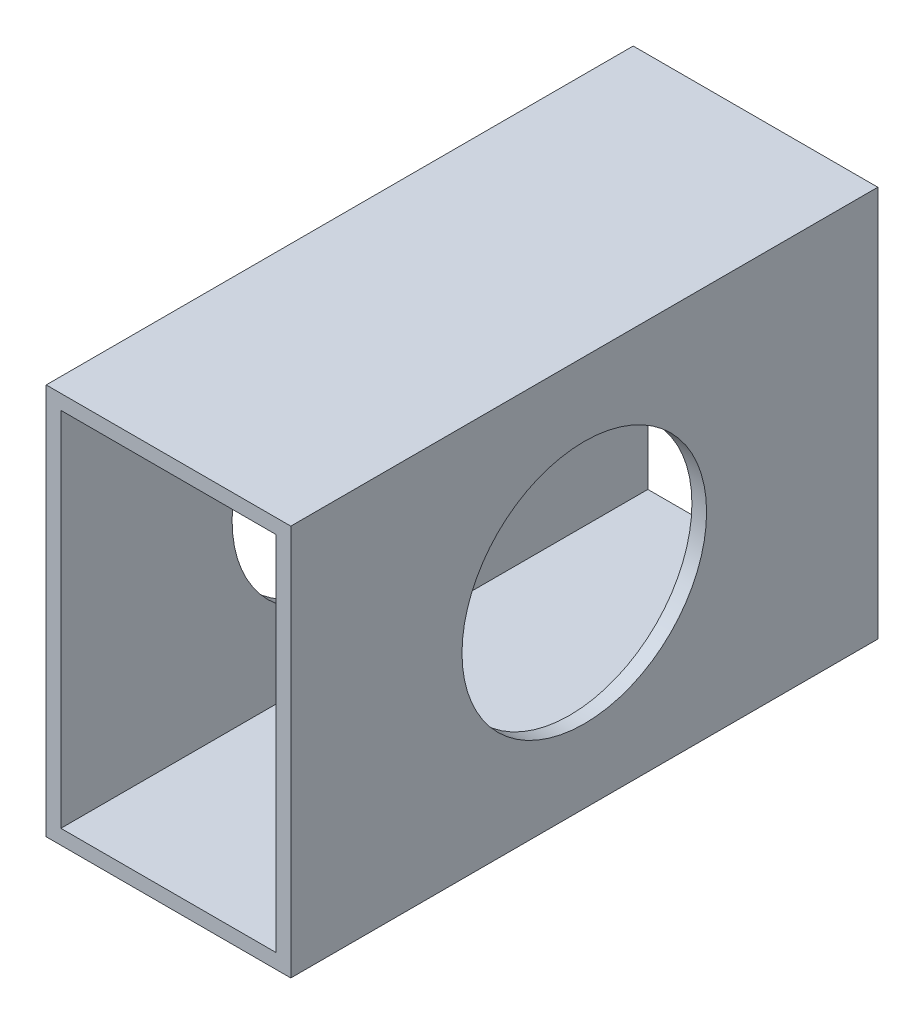
from build123d import *

# Parameters (mm, degrees)
SZKIC1_W                    = 50
SZKIC1_H                    = 80
SZKIC1_W_2                  = 44
SZKIC1_H_2                  = 74
DODANIE_WYCI_GNI_CIE1_DEPTH = 120
SZKIC2_R                    = 25
WYTNIJ_WYCI_GNI_CIE1_DEPTH  = 137.014705087


with BuildPart() as part:
    # Szkic1 → Dodanie-wyciągnięcie1 (new body)
    with BuildSketch(Plane.XY):
        Rectangle(SZKIC1_W, SZKIC1_H)
        Rectangle(SZKIC1_W_2, SZKIC1_H_2, mode=Mode.SUBTRACT)
    extrude(amount=DODANIE_WYCI_GNI_CIE1_DEPTH)

    # Szkic2 → Wytnij-wyciągnięcie1 (cut, through all)
    with BuildSketch(Plane(origin=(25, 0, 0), x_dir=(0, 0, -1), z_dir=(1, 0, 0))):
        with Locations((-60, 0)):
            Circle(SZKIC2_R)
    extrude(amount=-WYTNIJ_WYCI_GNI_CIE1_DEPTH, mode=Mode.SUBTRACT)


solid = part.part
